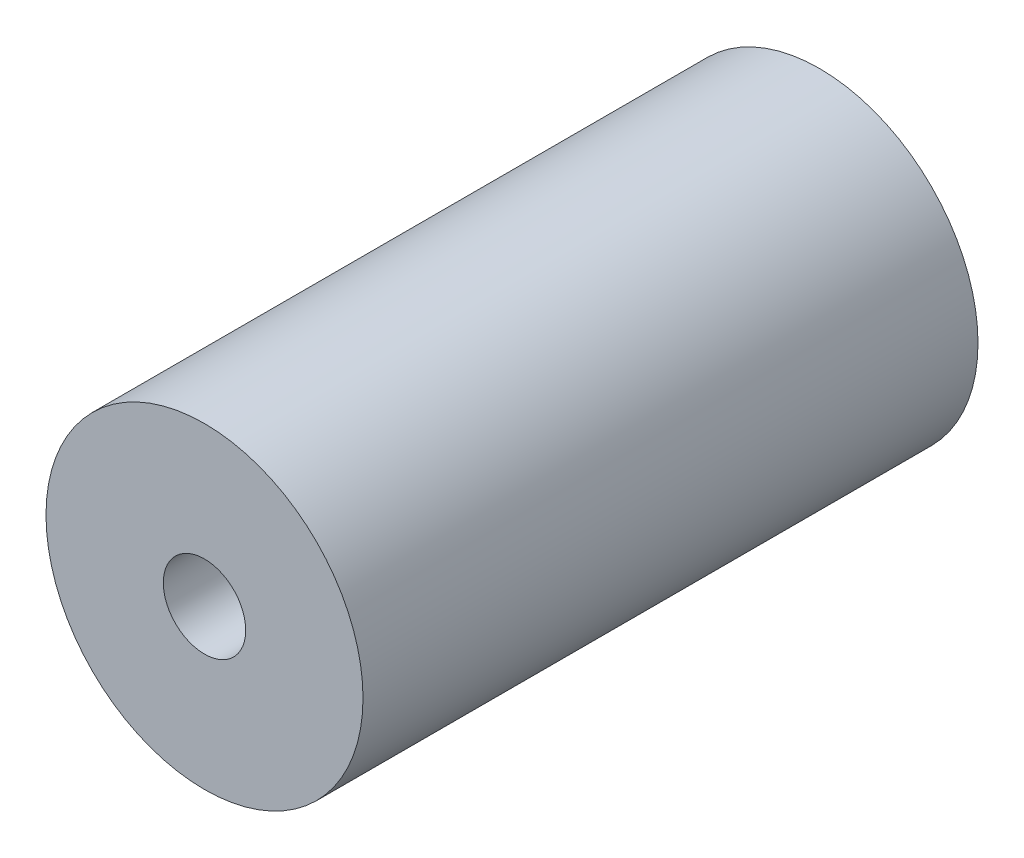
from build123d import *

# Parameters (mm, degrees)
SKETCH_1_R      = 5
SKETCH_1_R_2    = 1.3
EXTRUDE_1_DEPTH = 19.4


with BuildPart() as part:
    # ｽｹｯﾁ1 → ﾎﾞｽ - 押し出し1 (new body)
    with BuildSketch(Plane.XY):
        Circle(SKETCH_1_R)
        Circle(SKETCH_1_R_2, mode=Mode.SUBTRACT)
    extrude(amount=EXTRUDE_1_DEPTH)


solid = part.part
